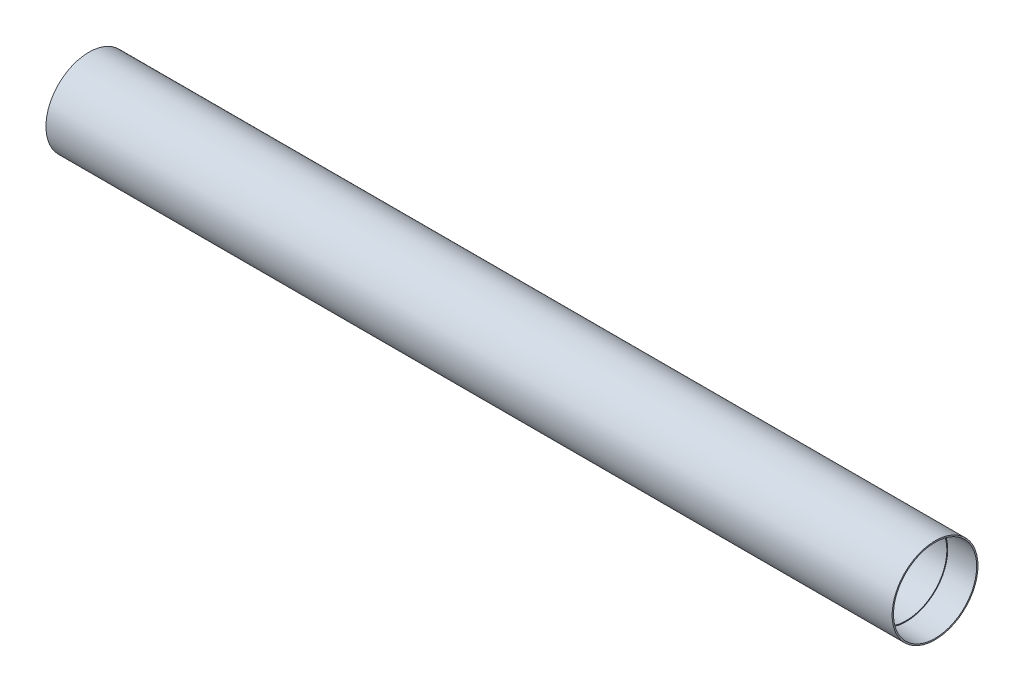
from build123d import *

# Parameters (mm, degrees)
SKETCH1_R           = 37.6555
BOSS_EXTRUDE1_DEPTH = 742.3404
SKETCH4_R           = 36.5
CUT_EXTRUDE2_DEPTH  = 25.4
CUT_EXTRUDE3_START  = -25.4
SKETCH5_R           = 36.5
CUT_EXTRUDE3_DEPTH  = 25.4
SKETCH6_R           = 35.75
CUT_EXTRUDE4_DEPTH  = 719.915440447


with BuildPart() as part:
    # Sketch1 → Boss-Extrude1 (new body)
    with BuildSketch(Plane(origin=(0, 0, 0), x_dir=(0, 0, -1), z_dir=(1, 0, 0))):
        Circle(SKETCH1_R)
    extrude(amount=BOSS_EXTRUDE1_DEPTH)

    # Sketch4 → Cut-Extrude2 (cut)
    with BuildSketch(Plane(origin=(742.3404, 0, 0), x_dir=(0, 0, -1), z_dir=(1, 0, 0))):
        Circle(SKETCH4_R)
    extrude(amount=-CUT_EXTRUDE2_DEPTH, mode=Mode.SUBTRACT)

    # Sketch5 → Cut-Extrude3 (cut)
    with BuildSketch(Plane.ZY.offset(CUT_EXTRUDE3_START)):
        with Locations(Location((0, 0, 0), (0, 0, 180))):
            Circle(SKETCH5_R)
    extrude(amount=CUT_EXTRUDE3_DEPTH, mode=Mode.SUBTRACT)

    # Sketch6 → Cut-Extrude4 (cut, through all)
    with BuildSketch(Plane(origin=(716.9404, 0, 0), x_dir=(0, 0, -1), z_dir=(1, 0, 0))):
        Circle(SKETCH6_R)
    extrude(amount=-CUT_EXTRUDE4_DEPTH, mode=Mode.SUBTRACT)


solid = part.part
